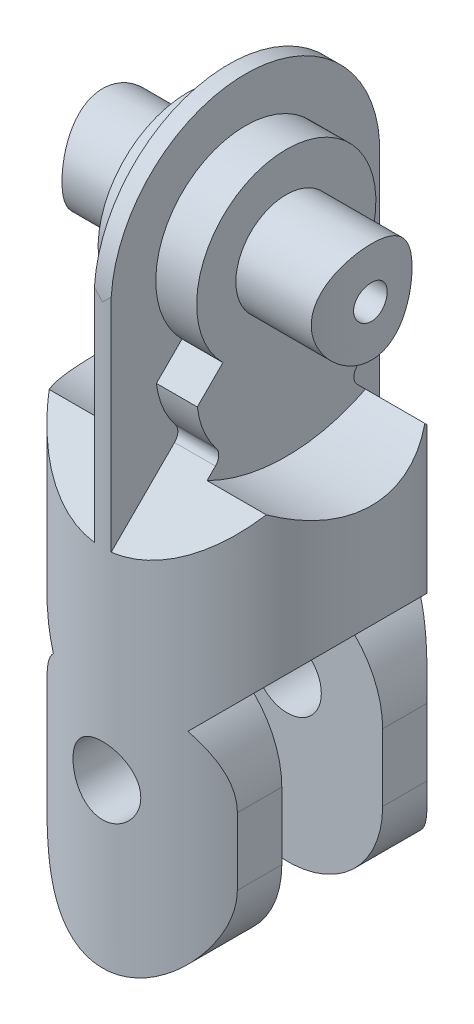
from build123d import *

# Parameters (mm, degrees)
SKETCH2_W                       = 12
SKETCH2_H                       = 31
CUT_EXTRUDE1_DEPTH              = 36.341194094
CUT_EXTRUDE1_DEPTH_BACK         = 36.341194094
CUT_EXTRUDE2_DEPTH              = 36.34119425
CUT_EXTRUDE2_DEPTH_BACK         = 36.34119425
SKETCH5_W                       = 8
SKETCH5_H                       = 8.9
SKETCH7_W                       = 9.25
SKETCH7_H                       = 15
CUT_EXTRUDE5_START              = -4.4
SKETCH8_R                       = 9.25
CUT_EXTRUDE5_DEPTH              = 30.911163805
BOSS_EXTRUDE1_REACH             = 36.311
SKETCH9_R                       = 8
BOSS_EXTRUDE1_DIRECTION_2_REACH = 36.311
CUT_EXTRUDE6_DEPTH              = 42.617304156
CUT_EXTRUDE6_DEPTH_BACK         = 42.617304156
SKETCH10_R                      = 1.95
CUT_EXTRUDE7_DEPTH              = 42.617304156
CUT_EXTRUDE7_DEPTH_BACK         = 42.617304156
SKETCH11_R                      = 2.025
BOSS_EXTRUDE2_START             = -8.8
BOSS_EXTRUDE2_DEPTH             = 8.8
SKETCH17_R                      = 2.025
CUT_EXTRUDE12_DEPTH             = 50.375702589
CUT_EXTRUDE13_DEPTH             = 50.375702586
CUT_EXTRUDE14_DEPTH             = 49.093658679
CUT_EXTRUDE14_DEPTH_BACK        = 49.093658679
SKETCH19_R                      = 9.25
FILLET7_R                       = 1
BOSS_EXTRUDE3_DEPTH             = 0.75
BOSS_EXTRUDE3_DEPTH_BACK        = 0.75
SKETCH20_R                      = 2.025
BOSS_EXTRUDE4_DEPTH             = 15
BOSS_EXTRUDE4_DEPTH_BACK        = 15
SKETCH21_R                      = 2.025
CUT_EXTRUDE16_DEPTH             = 4.5
CUT_EXTRUDE16_DEPTH_BACK        = 4.5
SKETCH32_R                      = 15.75
CUT_EXTRUDE19_DEPTH             = 10
BOSS_EXTRUDE7_DEPTH             = 10
BOSS_EXTRUDE8_DEPTH             = 15
BOSS_EXTRUDE8_DEPTH_BACK        = 15
SKETCH34_R                      = 4.5
SKETCH34_R_2                    = 1.5
CUT_EXTRUDE20_DEPTH             = 54.394756325
CUT_EXTRUDE20_DEPTH_BACK        = 54.394756325
SKETCH35_R                      = 3.025
CUT_EXTRUDE15_DEPTH             = 54.394756325
CUT_EXTRUDE15_DEPTH_BACK        = 54.394756325
SKETCH22_R                      = 25
SKETCH22_R_2                    = 12
SCALE1_SCALE                    = 0.333333


with BuildPart() as part:
    # Sketch2 → Revolve1 (revolve)
    with BuildSketch(Plane.XY):
        with Locations((-6, 15.5)):
            Rectangle(SKETCH2_W, SKETCH2_H)
    revolve(axis=Axis((0, 31, 0), (0, -1, 0)))

    # Sketch1 → Cut-Extrude1 (cut, two sides: drawn at the far end of the back side and taken through both)
    with BuildSketch(Plane.XY.offset(-CUT_EXTRUDE1_DEPTH_BACK)):
        with BuildLine():
            Line((-0.179605122, 0.179605122), (-12, 12))
            Line((-12, 12), (-12, -1))
            Line((-12, -1), (12, -1))
            Line((12, -1), (12, 12))
            Line((12, 12), (0.179605122, 0.179605122))
            ThreePointArc((0.179605122, 0.179605122), (0, 0.254), (-0.179605122, 0.179605122))
        make_face()
    extrude(amount=CUT_EXTRUDE1_DEPTH + CUT_EXTRUDE1_DEPTH_BACK, mode=Mode.SUBTRACT)

    # Sketch3 → Cut-Extrude2 (cut, two sides: drawn at the far end of the back side and taken through both)
    with BuildSketch(Plane(origin=(0, 0, 0), x_dir=(0, 0, -1), z_dir=(1, 0, 0)).offset(-CUT_EXTRUDE2_DEPTH_BACK)):
        with BuildLine():
            Line((-0.179605122, 29.820394878), (-12, 18))
            Line((-12, 18), (-12, 31))
            Line((-12, 31), (12, 31))
            Line((12, 31), (12, 18))
            Line((12, 18), (0.179605122, 29.820394878))
            ThreePointArc((0.179605122, 29.820394878), (0, 29.746), (-0.179605122, 29.820394878))
        make_face()
    extrude(amount=CUT_EXTRUDE2_DEPTH + CUT_EXTRUDE2_DEPTH_BACK, mode=Mode.SUBTRACT)

    # Sketch5 → Revolve2 (revolve)
    with BuildSketch(Plane(origin=(0, 0, 0), x_dir=(1, 0, 0), z_dir=(0, 1, 0))):
        with Locations((4, 0)):
            Rectangle(SKETCH5_W, SKETCH5_H)
    revolve(axis=Axis((0, 0, 4.45), (0, 0, 1)))

    # Sketch7 → Cut-Revolve1 (revolve, cut)
    with BuildSketch(Plane(origin=(0, 0, 0), x_dir=(1, 0, 0), z_dir=(0, 1, 0))):
        with Locations((4.625, -11.95)):
            Rectangle(SKETCH7_W, SKETCH7_H)
    cut_revolve1 = revolve(axis=Axis((0, 0, 19.45), (0, 0, -1)), mode=Mode.SUBTRACT)

    # Sketch8 → Cut-Extrude5 (cut, through all)
    with BuildSketch(Plane(origin=(0, 0, 0), x_dir=(0, 0, -1), z_dir=(1, 0, 0)).offset(CUT_EXTRUDE5_START)):
        with Locations((0, 30)):
            Circle(SKETCH8_R)
    cut_extrude5 = extrude(amount=-CUT_EXTRUDE5_DEPTH, mode=Mode.SUBTRACT)

    # Mirror1: Cut-Extrude5 across plane
    add(cut_extrude5.mirror(Plane(origin=(0, 0, 0), x_dir=(0, 0, 1), z_dir=(1, 0, 0))), mode=Mode.SUBTRACT)

    # Boss-Extrude1: up to this face of the body (flat: up to its plane)
    boss_extrude1_end = Plane(part.part.faces().sort_by_distance((4.4, 24.443974972, 0))[0])
    # Sketch9 → Boss-Extrude1 (add, up to the picked face)
    with BuildSketch(Plane(origin=(0, 0, 0), x_dir=(0, 0, -1), z_dir=(1, 0, 0)), mode=Mode.PRIVATE) as boss_extrude1_sk1:
        with Locations((0, 30)):
            Circle(SKETCH9_R)
    boss_extrude1_tool1 = split(extrude(boss_extrude1_sk1.sketch, amount=BOSS_EXTRUDE1_REACH, mode=Mode.PRIVATE), bisect_by=boss_extrude1_end, keep=Keep.BOTH, mode=Mode.PRIVATE)
    add(boss_extrude1_tool1.solids().sort_by(Axis((0, 30, 0), (1, 0, 0)))[0])

    # Boss-Extrude1 direction 2: up to this face of the body (flat: up to its plane)
    boss_extrude1_direction_2_end = Plane(part.part.faces().sort_by_distance((-4.4, 24.443974972, 0))[0])
    # Sketch9 → Boss-Extrude1 direction 2 (add, up to the picked face)
    with BuildSketch(Plane(origin=(0, 0, 0), x_dir=(0, 0, -1), z_dir=(1, 0, 0)), mode=Mode.PRIVATE) as boss_extrude1_direction_2_sk1:
        with Locations((0, 30)):
            Circle(SKETCH9_R)
    boss_extrude1_direction_2_tool1 = split(extrude(boss_extrude1_direction_2_sk1.sketch, amount=-BOSS_EXTRUDE1_DIRECTION_2_REACH, mode=Mode.PRIVATE), bisect_by=boss_extrude1_direction_2_end, keep=Keep.BOTH, mode=Mode.PRIVATE)
    add(boss_extrude1_direction_2_tool1.solids().sort_by(Axis((0, 30, 0), (-1, 0, 0)))[0])

    # Mirror2: Cut-Revolve1 across plane
    add(cut_revolve1.mirror(Plane.XY), mode=Mode.SUBTRACT)

    # Sketch10 → Cut-Extrude6 (cut, two sides: drawn at the far end of the back side and taken through both)
    with BuildSketch(Plane(origin=(0, 0, 0), x_dir=(0, 0, -1), z_dir=(1, 0, 0)).offset(-CUT_EXTRUDE6_DEPTH_BACK)):
        with Locations((0, 30)):
            Circle(SKETCH10_R)
    extrude(amount=CUT_EXTRUDE6_DEPTH + CUT_EXTRUDE6_DEPTH_BACK, mode=Mode.SUBTRACT)

    # Sketch11 → Cut-Extrude7 (cut, two sides: drawn at the far end of the back side and taken through both)
    with BuildSketch(Plane.XY.offset(-CUT_EXTRUDE7_DEPTH_BACK)):
        Circle(SKETCH11_R)
    extrude(amount=CUT_EXTRUDE7_DEPTH + CUT_EXTRUDE7_DEPTH_BACK, mode=Mode.SUBTRACT)

    # Sketch16 → Boss-Extrude2 (add)
    with BuildSketch(Plane.ZY.offset(4.4).offset(BOSS_EXTRUDE2_START)):
        with BuildLine():
            Line((-8, 30), (-8, 37))
            ThreePointArc((-8, 37), (0, 45), (8, 37))
            Line((8, 37), (8, 30))
            ThreePointArc((8, 30), (0, 22), (-8, 30))
        make_face()
    extrude(amount=BOSS_EXTRUDE2_DEPTH)

    # Sketch17 → Cut-Extrude12 (cut, through all)
    with BuildSketch(Plane.ZY.offset(4.4)):
        with Locations((0, 37)):
            Circle(SKETCH17_R)
    extrude(amount=-CUT_EXTRUDE12_DEPTH, mode=Mode.SUBTRACT)

    # Sketch18 → Cut-Extrude13 (cut, through all)
    with BuildSketch(Plane(origin=(4.4, 0, 0), x_dir=(0, 0, -1), z_dir=(1, 0, 0))):
        with BuildLine():
            Line((5.656854249, 31.343145751), (7.944097209, 29.055902791))
            ThreePointArc((7.944097209, 29.055902791), (7.986012073, 29.527124577), (8, 30))
            Line((8, 30), (8, 37))
            ThreePointArc((8, 37), (7.39103626, 33.938532541), (5.656854249, 31.343145751))
        make_face()
        with BuildLine():
            Line((-8, 30), (-8, 37))
            ThreePointArc((-8, 37), (-7.39103626, 33.938532541), (-5.656854249, 31.343145751))
            Line((-5.656854249, 31.343145751), (-7.944097209, 29.055902791))
            ThreePointArc((-7.944097209, 29.055902791), (-7.986012073, 29.527124577), (-8, 30))
        make_face()
    extrude(amount=-CUT_EXTRUDE13_DEPTH, mode=Mode.SUBTRACT)

    # Sketch19 → Cut-Extrude14 (cut, two sides: drawn at the far end of the back side and taken through both)
    with BuildSketch(Plane.XY.offset(-CUT_EXTRUDE14_DEPTH_BACK)):
        Circle(SKETCH19_R)
    extrude(amount=CUT_EXTRUDE14_DEPTH + CUT_EXTRUDE14_DEPTH_BACK, mode=Mode.SUBTRACT)

    # Fillet7
    fillet7_edges = [part.edges().sort_by_distance(p)[0] for p in [
        (0, 24.343145751, 5.656854249),
        (0, 24.343145751, -5.656854249),
    ]]
    fillet(fillet7_edges, radius=FILLET7_R)

    # Sketch20 → Boss-Extrude3 (add, two sides: drawn at the far end of the back side and taken through both)
    with BuildSketch(Plane(origin=(0, 0, 0), x_dir=(0, 0, -1), z_dir=(1, 0, 0)).offset(-BOSS_EXTRUDE3_DEPTH_BACK)):
        with BuildLine():
            Line((0, 30), (-12, 18))
            Line((-12, 18), (-12, 37))
            ThreePointArc((-12, 37), (0, 49), (12, 37))
            Line((12, 37), (12, 18))
            Line((12, 18), (0, 30))
        make_face()
        with Locations(Location((0, 37, 0), (0, 0, 180))):
            Circle(SKETCH20_R, mode=Mode.SUBTRACT)
    extrude(amount=BOSS_EXTRUDE3_DEPTH + BOSS_EXTRUDE3_DEPTH_BACK)

    # Sketch21 → Boss-Extrude4 (add, two sides: drawn at the far end of the back side and taken through both)
    with BuildSketch(Plane.XY.offset(-BOSS_EXTRUDE4_DEPTH_BACK)):
        with BuildLine():
            Line((8.5, 0), (8.5, -6))
            ThreePointArc((8.5, -6), (0, -14.5), (-8.5, -6))
            Line((-8.5, -6), (-8.5, 0))
            ThreePointArc((-8.5, 0), (-7.852976026, 3.252809175), (-6.01040764, 6.01040764))
            Line((-6.01040764, 6.01040764), (-6.540737726, 6.540737726))
            ThreePointArc((-6.540737726, 6.540737726), (0, 9.25), (6.540737726, 6.540737726))
            Line((6.540737726, 6.540737726), (6.01040764, 6.01040764))
            ThreePointArc((6.01040764, 6.01040764), (7.852976026, 3.252809175), (8.5, 0))
        make_face()
        Circle(SKETCH21_R, mode=Mode.SUBTRACT)
    extrude(amount=BOSS_EXTRUDE4_DEPTH + BOSS_EXTRUDE4_DEPTH_BACK)

    # Sketch23 → Cut-Extrude16 (cut, two sides: drawn at the far end of the back side and taken through both)
    with BuildSketch(Plane.XY.offset(-CUT_EXTRUDE16_DEPTH_BACK)):
        with BuildLine():
            Line((9, 0), (9, -6))
            ThreePointArc((9, -6), (0, -15), (-9, -6))
            Line((-9, -6), (-9, 0))
            ThreePointArc((-9, 0), (0, 9), (9, 0))
        make_face()
    extrude(amount=CUT_EXTRUDE16_DEPTH + CUT_EXTRUDE16_DEPTH_BACK, mode=Mode.SUBTRACT)

    # Sketch32 → Cut-Extrude19 (cut)
    with BuildSketch(Plane(origin=(4.4, 0, 0), x_dir=(0, 0, -1), z_dir=(1, 0, 0))):
        with Locations((0, 37)):
            Circle(SKETCH32_R)
    cut_extrude19 = extrude(amount=CUT_EXTRUDE19_DEPTH, mode=Mode.SUBTRACT)

    # Sketch33 → Boss-Extrude7 (add)
    with BuildSketch(Plane(origin=(4.4, 0, 0), x_dir=(0, 0, -1), z_dir=(1, 0, 0))):
        with BuildLine():
            ThreePointArc((-4.453844934, 21.892857143), (0, 20.75), (4.453844934, 21.892857143))
            ThreePointArc((4.453844934, 21.892857143), (0, 21.25), (-4.453844934, 21.892857143))
        make_face()
    boss_extrude7 = extrude(amount=BOSS_EXTRUDE7_DEPTH)

    # Mirror8: Cut-Extrude19, Boss-Extrude7 across plane
    add(cut_extrude19.mirror(Plane(origin=(0, 0, 0), x_dir=(0, 0, 1), z_dir=(1, 0, 0))), mode=Mode.SUBTRACT)
    add(boss_extrude7.mirror(Plane(origin=(0, 0, 0), x_dir=(0, 0, 1), z_dir=(1, 0, 0))))

    # Sketch34 → Boss-Extrude8 (add, two sides: drawn at the far end of the back side and taken through both)
    with BuildSketch(Plane(origin=(0, 0, 0), x_dir=(0, 0, -1), z_dir=(1, 0, 0)).offset(-BOSS_EXTRUDE8_DEPTH_BACK)):
        with Locations((0, 37)):
            Circle(SKETCH34_R)
        with Locations((0, 37)):
            Circle(SKETCH34_R_2, mode=Mode.SUBTRACT)
    extrude(amount=BOSS_EXTRUDE8_DEPTH + BOSS_EXTRUDE8_DEPTH_BACK)

    # Sketch35 → Cut-Extrude20 (cut, two sides: drawn at the far end of the back side and taken through both)
    with BuildSketch(Plane.XY.offset(-CUT_EXTRUDE20_DEPTH_BACK)):
        Circle(SKETCH35_R)
    extrude(amount=CUT_EXTRUDE20_DEPTH + CUT_EXTRUDE20_DEPTH_BACK, mode=Mode.SUBTRACT)

    # Sketch22 → Cut-Extrude15 (cut, two sides: drawn at the far end of the back side and taken through both)
    with BuildSketch(Plane(origin=(0, 0, 0), x_dir=(1, 0, 0), z_dir=(0, 1, 0)).offset(-CUT_EXTRUDE15_DEPTH_BACK)):
        Circle(SKETCH22_R)
        with Locations(Location((0, 0, 0), (0, 0, 143.886361182))):
            Circle(SKETCH22_R_2, mode=Mode.SUBTRACT)
    extrude(amount=CUT_EXTRUDE15_DEPTH + CUT_EXTRUDE15_DEPTH_BACK, mode=Mode.SUBTRACT)


with BuildPart() as part_1:
    # Scale1: scaled about (4.746e-06, 15.196007335, -3.8195e-05)
    add(part.part.scale(SCALE1_SCALE).moved(Location((3.164e-06, 10.130676622, -2.5463e-05))))


solid = part_1.part
